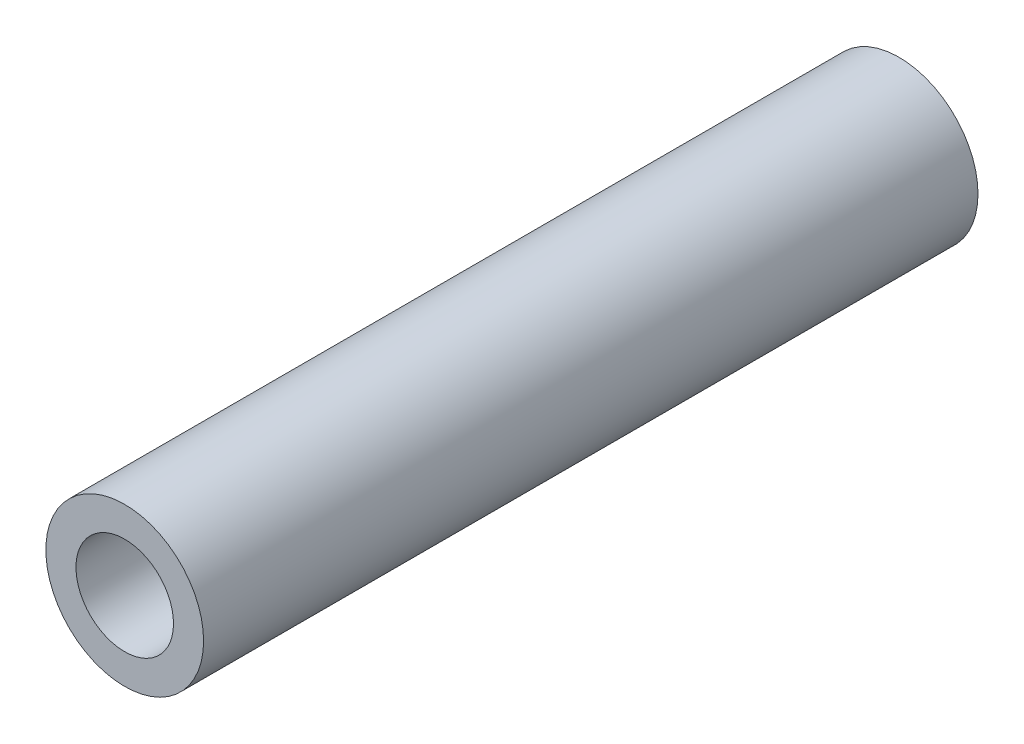
from build123d import *

# Parameters (mm, degrees)
SKETCH_1_R      = 2.75
SKETCH_1_R_2    = 1.7
EXTRUDE_1_DEPTH = 27


with BuildPart() as part:
    # 草图1 → 凸台-拉伸1 (new body)
    with BuildSketch(Plane.XY):
        Circle(SKETCH_1_R)
        Circle(SKETCH_1_R_2, mode=Mode.SUBTRACT)
    extrude(amount=EXTRUDE_1_DEPTH)


solid = part.part
